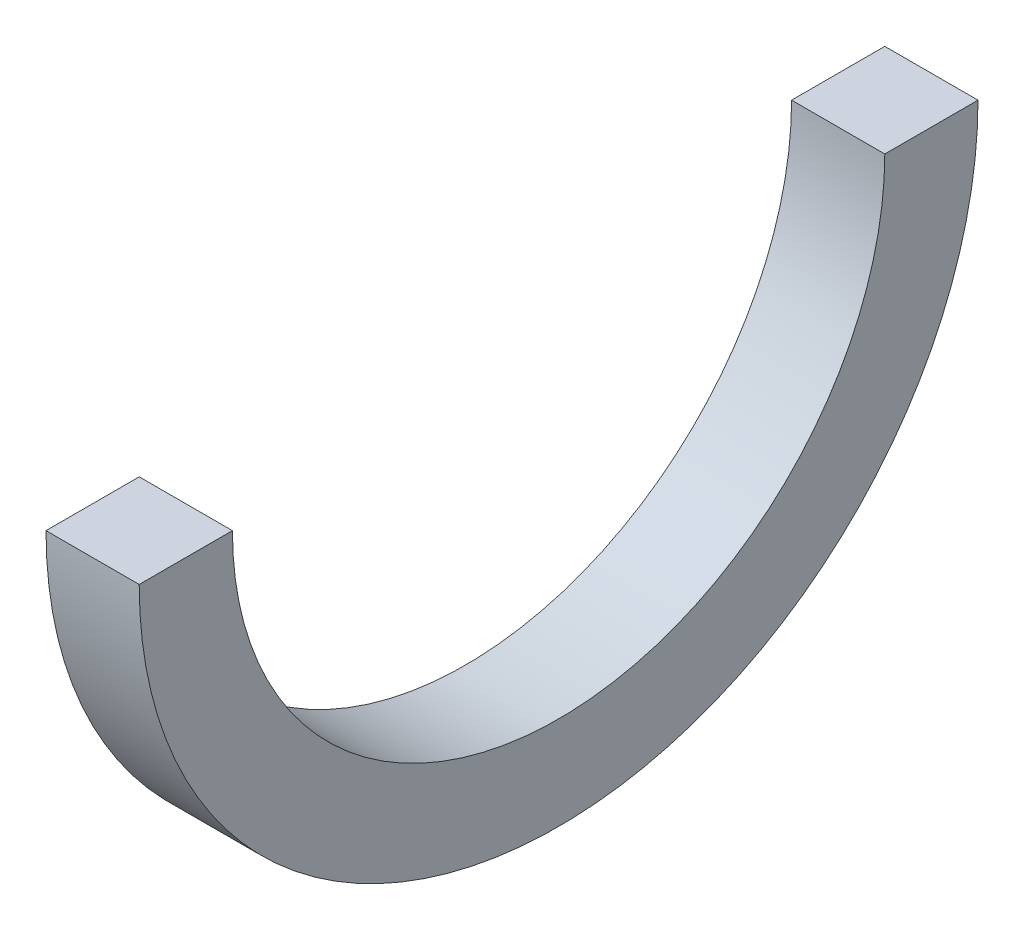
from build123d import *

# Parameters (mm, degrees)
BOSS_EXTRUDE1_DEPTH = 2.5


with BuildPart() as part:
    # Sketch1 → Boss-Extrude1 (new, symmetric)
    with BuildSketch(Plane(origin=(0, 0, 0), x_dir=(0, 0, -1), z_dir=(1, 0, 0))):
        with BuildLine():
            Line((-22.5, 0), (-17.5, 0))
            ThreePointArc((-17.5, 0), (0, -17.5), (17.5, 0))
            Line((17.5, 0), (22.5, 0))
            ThreePointArc((22.5, 0), (0, -22.5), (-22.5, 0))
        make_face()
    extrude(amount=BOSS_EXTRUDE1_DEPTH, both=True)


solid = part.part
